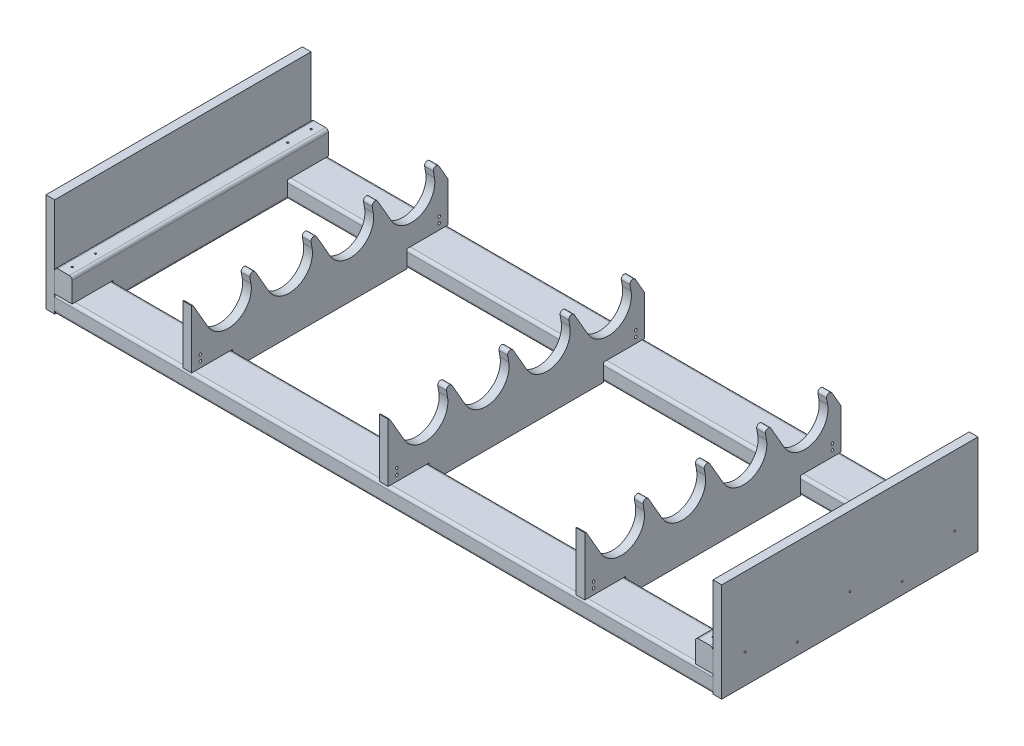
from build123d import *

# Parameters (mm, degrees)
SKETCH1_W                           = 1435.1
SKETCH1_H                           = 88.9
BOSS_EXTRUDE1_DEPTH                 = 38.1
BOSS_EXTRUDE1_2_DEPTH               = 38.1
FILLET2_R                           = 6.35
FILLET3_R                           = 6.35
BOSS_EXTRUDE4_DEPTH                 = 38.1
FILLET4_R                           = 6.35
TAP_DRILL_FOR_10_24_TAP1_AT_2_COUNT = 2
TAP_DRILL_FOR_10_24_TAP1_AT_2_PITCH = 50.8
TAP_DRILL_FOR_10_24_TAP1_AT_3_COUNT = 2
TAP_DRILL_FOR_10_24_TAP1_AT_3_PITCH = 469.9
TAP_DRILL_FOR_10_24_TAP1_AT_4_COUNT = 2
TAP_DRILL_FOR_10_24_TAP1_AT_4_PITCH = 520.7
TAP_DRILL_FOR_10_24_TAP1_AT_5_COUNT = 2
TAP_DRILL_FOR_10_24_TAP1_AT_5_PITCH = 1490.884801049
TAP_DRILL_FOR_10_24_TAP1_AT_6_COUNT = 2
TAP_DRILL_FOR_10_24_TAP1_AT_6_PITCH = 1473.911466134
TAP_DRILL_FOR_10_24_TAP1_AT_7_COUNT = 2
TAP_DRILL_FOR_10_24_TAP1_AT_7_PITCH = 1397.923331231
TAP_DRILL_FOR_10_24_TAP1_AT_8_COUNT = 2
TAP_DRILL_FOR_10_24_TAP1_AT_8_PITCH = 1397
SKETCH2_W                           = 558.8
SKETCH2_H                           = 215.9
BOSS_EXTRUDE2_DEPTH                 = 19.05
TAP_DRILL_FOR_10_24_TAP2_AT_2_COUNT = 2
TAP_DRILL_FOR_10_24_TAP2_AT_2_PITCH = 120.482778852
TAP_DRILL_FOR_10_24_TAP2_AT_3_COUNT = 2
TAP_DRILL_FOR_10_24_TAP2_AT_3_PITCH = 228.6
TAP_DRILL_FOR_10_24_TAP2_AT_4_COUNT = 2
TAP_DRILL_FOR_10_24_TAP2_AT_4_PITCH = 345.010173763
TAP_DRILL_FOR_10_24_TAP2_AT_5_COUNT = 2
TAP_DRILL_FOR_10_24_TAP2_AT_5_PITCH = 457.2
TAP_DRILL_FOR_10_24_TAP3_AT_2_COUNT = 2
TAP_DRILL_FOR_10_24_TAP3_AT_2_PITCH = 120.482778852
TAP_DRILL_FOR_10_24_TAP3_AT_3_COUNT = 2
TAP_DRILL_FOR_10_24_TAP3_AT_3_PITCH = 228.6
TAP_DRILL_FOR_10_24_TAP3_AT_4_COUNT = 2
TAP_DRILL_FOR_10_24_TAP3_AT_4_PITCH = 345.010173763
TAP_DRILL_FOR_10_24_TAP3_AT_5_COUNT = 2
TAP_DRILL_FOR_10_24_TAP3_AT_5_PITCH = 457.2
BOSS_EXTRUDE3_DEPTH                 = 19.05
CUT_EXTRUDE1_DEPTH                  = 19.05
FILLET1_R                           = 6.35
SKETCH14_W                          = 2.8067
SKETCH14_H                          = 19.051
F_10_CLEARANCE_HOLE1_AT_2_COUNT     = 2
F_10_CLEARANCE_HOLE1_AT_2_PITCH     = 12.7
F_10_CLEARANCE_HOLE1_AT_3_COUNT     = 2
F_10_CLEARANCE_HOLE1_AT_3_PITCH     = 520.7
F_10_CLEARANCE_HOLE1_AT_4_COUNT     = 2
F_10_CLEARANCE_HOLE1_AT_4_PITCH     = 520.854855022


with BuildPart() as part:
    # Sketch1 → Boss-Extrude1 (new body)
    with BuildSketch(Plane(origin=(0, 0, 0), x_dir=(1, 0, 0), z_dir=(0, 1, 0))):
        with Locations((0, 234.95)):
            Rectangle(SKETCH1_W, SKETCH1_H)
    extrude(amount=BOSS_EXTRUDE1_DEPTH)

    # Fillet3
    fillet3_edges = [part.edges().sort_by_distance(p)[0] for p in [
        (0, 38.1, -279.4),
        (0, 0, -279.4),
        (0, 0, -190.5),
        (0, 38.1, -190.5),
    ]]
    fillet(fillet3_edges, radius=FILLET3_R)


with BuildPart() as body_2:
    # Sketch1 → Boss-Extrude1 2 (new body)
    with BuildSketch(Plane(origin=(0, 0, 0), x_dir=(1, 0, 0), z_dir=(0, 1, 0))):
        with Locations((0, -234.95)):
            Rectangle(SKETCH1_W, SKETCH1_H)
    extrude(amount=BOSS_EXTRUDE1_2_DEPTH)

    # Fillet2
    fillet2_edges = [body_2.edges().sort_by_distance(p)[0] for p in [
        (0, 0, 190.5),
        (0, 0, 279.4),
        (0, 38.1, 190.5),
        (0, 38.1, 279.4),
    ]]
    fillet(fillet2_edges, radius=FILLET2_R)


with BuildPart() as body_3:
    # Sketch5 → Boss-Extrude4 (new body)
    with BuildSketch(Plane(origin=(717.55, 0, 0), x_dir=(0, 0, -1), z_dir=(1, 0, 0))):
        Polygon((-279.4, 88.9), (279.4, 88.9), (279.4, 38.1), (190.5, 38.1), (190.5, 0), (-190.5, 0), (-190.5, 38.1), (-279.4, 38.1), align=None)
    extrude(amount=-BOSS_EXTRUDE4_DEPTH)

    # Fillet4
    fillet4_edges = [body_3.edges().sort_by_distance(p)[0] for p in [
        (717.55, 0, 0),
        (679.45, 0, 0),
        (679.45, 88.9, 0),
        (717.55, 88.9, 0),
    ]]
    fillet(fillet4_edges, radius=FILLET4_R)


with BuildPart() as body_4:
    # Mirror6: mirrored copy
    add(body_3.part.mirror(Plane(origin=(0, 0, 0), x_dir=(0, 0, 1), z_dir=(1, 0, 0))))


with BuildPart() as tap_drill_for_10_24_tap1_tool:
    # Sketch8 → Tap Drill for #10-24 Tap1 (revolve)
    with BuildSketch(Plane(origin=(698.5, 88.9, 260.35), x_dir=(0, 0, 1), z_dir=(1, 0, 0))):
        Polygon((0, 0), (0, 77.340824014), (1.89865, 76.2), (1.89865, 0), align=None)
    tap_drill_for_10_24_tap1 = revolve(axis=Axis((698.5, 95.25, 260.35), (0, -1, 0)))


with BuildPart() as body_2_1:
    add(body_2.part)

    # Tap Drill for #10-24 Tap1: cut by tap_drill_for_10_24_tap1_tool
    add(tap_drill_for_10_24_tap1_tool.part, mode=Mode.SUBTRACT)


with BuildPart() as body_3_1:
    add(body_3.part)

    # Tap Drill for #10-24 Tap1: cut by tap_drill_for_10_24_tap1_tool
    add(tap_drill_for_10_24_tap1_tool.part, mode=Mode.SUBTRACT)


with BuildPart() as tap_drill_for_10_24_tap1_at_2_tool:
    # Tap Drill for #10-24 Tap1 at 2: Tap Drill for #10-24 Tap1 ×2
    with Locations(*[(0, 0, -i * TAP_DRILL_FOR_10_24_TAP1_AT_2_PITCH) for i in range(1, TAP_DRILL_FOR_10_24_TAP1_AT_2_COUNT)]):
        add(tap_drill_for_10_24_tap1)


with BuildPart() as body_2_2:
    add(body_2_1.part)

    # Tap Drill for #10-24 Tap1 at 2: cut by tap_drill_for_10_24_tap1_at_2_tool
    add(tap_drill_for_10_24_tap1_at_2_tool.part, mode=Mode.SUBTRACT)


with BuildPart() as body_3_2:
    add(body_3_1.part)

    # Tap Drill for #10-24 Tap1 at 2: cut by tap_drill_for_10_24_tap1_at_2_tool
    add(tap_drill_for_10_24_tap1_at_2_tool.part, mode=Mode.SUBTRACT)


with BuildPart() as tap_drill_for_10_24_tap1_at_3_tool:
    # Tap Drill for #10-24 Tap1 at 3: Tap Drill for #10-24 Tap1 ×2
    with Locations(*[(0, 0, -i * TAP_DRILL_FOR_10_24_TAP1_AT_3_PITCH) for i in range(1, TAP_DRILL_FOR_10_24_TAP1_AT_3_COUNT)]):
        add(tap_drill_for_10_24_tap1)


with BuildPart() as part_1:
    add(part.part)

    # Tap Drill for #10-24 Tap1 at 3: cut by tap_drill_for_10_24_tap1_at_3_tool
    add(tap_drill_for_10_24_tap1_at_3_tool.part, mode=Mode.SUBTRACT)


with BuildPart() as body_3_3:
    add(body_3_2.part)

    # Tap Drill for #10-24 Tap1 at 3: cut by tap_drill_for_10_24_tap1_at_3_tool
    add(tap_drill_for_10_24_tap1_at_3_tool.part, mode=Mode.SUBTRACT)


with BuildPart() as tap_drill_for_10_24_tap1_at_4_tool:
    # Tap Drill for #10-24 Tap1 at 4: Tap Drill for #10-24 Tap1 ×2
    with Locations(*[(0, 0, -i * TAP_DRILL_FOR_10_24_TAP1_AT_4_PITCH) for i in range(1, TAP_DRILL_FOR_10_24_TAP1_AT_4_COUNT)]):
        add(tap_drill_for_10_24_tap1)


with BuildPart() as part_2:
    add(part_1.part)

    # Tap Drill for #10-24 Tap1 at 4: cut by tap_drill_for_10_24_tap1_at_4_tool
    add(tap_drill_for_10_24_tap1_at_4_tool.part, mode=Mode.SUBTRACT)


with BuildPart() as body_3_4:
    add(body_3_3.part)

    # Tap Drill for #10-24 Tap1 at 4: cut by tap_drill_for_10_24_tap1_at_4_tool
    add(tap_drill_for_10_24_tap1_at_4_tool.part, mode=Mode.SUBTRACT)


with BuildPart() as tap_drill_for_10_24_tap1_at_5_tool:
    # Tap Drill for #10-24 Tap1 at 5: Tap Drill for #10-24 Tap1 ×2
    with Locations(*[Vector(-0.9370274611537509, 0, -0.34925569006639823) * (i * TAP_DRILL_FOR_10_24_TAP1_AT_5_PITCH) for i in range(1, TAP_DRILL_FOR_10_24_TAP1_AT_5_COUNT)]):
        add(tap_drill_for_10_24_tap1)


with BuildPart() as part_3:
    add(part_2.part)

    # Tap Drill for #10-24 Tap1 at 5: cut by tap_drill_for_10_24_tap1_at_5_tool
    add(tap_drill_for_10_24_tap1_at_5_tool.part, mode=Mode.SUBTRACT)


with BuildPart() as body_4_1:
    add(body_4.part)

    # Tap Drill for #10-24 Tap1 at 5: cut by tap_drill_for_10_24_tap1_at_5_tool
    add(tap_drill_for_10_24_tap1_at_5_tool.part, mode=Mode.SUBTRACT)


with BuildPart() as tap_drill_for_10_24_tap1_at_6_tool:
    # Tap Drill for #10-24 Tap1 at 6: Tap Drill for #10-24 Tap1 ×2
    with Locations(*[Vector(-0.9478181234756763, 0, -0.31881155062363686) * (i * TAP_DRILL_FOR_10_24_TAP1_AT_6_PITCH) for i in range(1, TAP_DRILL_FOR_10_24_TAP1_AT_6_COUNT)]):
        add(tap_drill_for_10_24_tap1)


with BuildPart() as part_4:
    add(part_3.part)

    # Tap Drill for #10-24 Tap1 at 6: cut by tap_drill_for_10_24_tap1_at_6_tool
    add(tap_drill_for_10_24_tap1_at_6_tool.part, mode=Mode.SUBTRACT)


with BuildPart() as body_4_2:
    add(body_4_1.part)

    # Tap Drill for #10-24 Tap1 at 6: cut by tap_drill_for_10_24_tap1_at_6_tool
    add(tap_drill_for_10_24_tap1_at_6_tool.part, mode=Mode.SUBTRACT)


with BuildPart() as tap_drill_for_10_24_tap1_at_7_tool:
    # Tap Drill for #10-24 Tap1 at 7: Tap Drill for #10-24 Tap1 ×2
    with Locations(*[Vector(-0.9993394979464322, 0, -0.03633961810714282) * (i * TAP_DRILL_FOR_10_24_TAP1_AT_7_PITCH) for i in range(1, TAP_DRILL_FOR_10_24_TAP1_AT_7_COUNT)]):
        add(tap_drill_for_10_24_tap1)


with BuildPart() as body_2_3:
    add(body_2_2.part)

    # Tap Drill for #10-24 Tap1 at 7: cut by tap_drill_for_10_24_tap1_at_7_tool
    add(tap_drill_for_10_24_tap1_at_7_tool.part, mode=Mode.SUBTRACT)


with BuildPart() as body_4_3:
    add(body_4_2.part)

    # Tap Drill for #10-24 Tap1 at 7: cut by tap_drill_for_10_24_tap1_at_7_tool
    add(tap_drill_for_10_24_tap1_at_7_tool.part, mode=Mode.SUBTRACT)


with BuildPart() as tap_drill_for_10_24_tap1_at_8_tool:
    # Tap Drill for #10-24 Tap1 at 8: Tap Drill for #10-24 Tap1 ×2
    with Locations(*[(-i * TAP_DRILL_FOR_10_24_TAP1_AT_8_PITCH, 0, 0) for i in range(1, TAP_DRILL_FOR_10_24_TAP1_AT_8_COUNT)]):
        add(tap_drill_for_10_24_tap1)


with BuildPart() as body_2_4:
    add(body_2_3.part)

    # Tap Drill for #10-24 Tap1 at 8: cut by tap_drill_for_10_24_tap1_at_8_tool
    add(tap_drill_for_10_24_tap1_at_8_tool.part, mode=Mode.SUBTRACT)


with BuildPart() as body_4_4:
    add(body_4_3.part)

    # Tap Drill for #10-24 Tap1 at 8: cut by tap_drill_for_10_24_tap1_at_8_tool
    add(tap_drill_for_10_24_tap1_at_8_tool.part, mode=Mode.SUBTRACT)


with BuildPart() as body_5:
    # Sketch2 → Boss-Extrude2 (new body)
    with BuildSketch(Plane(origin=(717.55, 0, 0), x_dir=(0, 0, -1), z_dir=(1, 0, 0))):
        with Locations((0, 107.95)):
            Rectangle(SKETCH2_W, SKETCH2_H)
    extrude(amount=BOSS_EXTRUDE2_DEPTH)


with BuildPart() as body_6:
    # Mirror2: mirrored copy
    add(body_5.part.mirror(Plane(origin=(0, 0, 0), x_dir=(0, 0, 1), z_dir=(1, 0, 0))))


with BuildPart() as tap_drill_for_10_24_tap2_tool:
    # Sketch10 → Tap Drill for #10-24 Tap2 (revolve)
    with BuildSketch(Plane(origin=(736.6, 63.5, 228.6), x_dir=(0, 0, -1), z_dir=(0, 1, 0))):
        Polygon((0, 0), (0, 39.240824014), (1.89865, 38.1), (1.89865, 0), align=None)
    tap_drill_for_10_24_tap2 = revolve(axis=Axis((742.95, 63.5, 228.6), (-1, 0, 0)))


with BuildPart() as body_3_5:
    add(body_3_4.part)

    # Tap Drill for #10-24 Tap2: cut by tap_drill_for_10_24_tap2_tool
    add(tap_drill_for_10_24_tap2_tool.part, mode=Mode.SUBTRACT)


with BuildPart() as body_5_1:
    add(body_5.part)

    # Tap Drill for #10-24 Tap2: cut by tap_drill_for_10_24_tap2_tool
    add(tap_drill_for_10_24_tap2_tool.part, mode=Mode.SUBTRACT)


with BuildPart() as tap_drill_for_10_24_tap2_at_2_tool:
    # Tap Drill for #10-24 Tap2 at 2: Tap Drill for #10-24 Tap2 ×2
    with Locations(*[Vector(-2.358985217731327e-15, -0.31622776601683794, -0.9486832980505139) * (i * TAP_DRILL_FOR_10_24_TAP2_AT_2_PITCH) for i in range(1, TAP_DRILL_FOR_10_24_TAP2_AT_2_COUNT)]):
        add(tap_drill_for_10_24_tap2)


with BuildPart() as body_3_6:
    add(body_3_5.part)

    # Tap Drill for #10-24 Tap2 at 2: cut by tap_drill_for_10_24_tap2_at_2_tool
    add(tap_drill_for_10_24_tap2_at_2_tool.part, mode=Mode.SUBTRACT)


with BuildPart() as body_5_2:
    add(body_5_1.part)

    # Tap Drill for #10-24 Tap2 at 2: cut by tap_drill_for_10_24_tap2_at_2_tool
    add(tap_drill_for_10_24_tap2_at_2_tool.part, mode=Mode.SUBTRACT)


with BuildPart() as tap_drill_for_10_24_tap2_at_3_tool:
    # Tap Drill for #10-24 Tap2 at 3: Tap Drill for #10-24 Tap2 ×2
    with Locations(*[(0, 0, -i * TAP_DRILL_FOR_10_24_TAP2_AT_3_PITCH) for i in range(1, TAP_DRILL_FOR_10_24_TAP2_AT_3_COUNT)]):
        add(tap_drill_for_10_24_tap2)


with BuildPart() as body_3_7:
    add(body_3_6.part)

    # Tap Drill for #10-24 Tap2 at 3: cut by tap_drill_for_10_24_tap2_at_3_tool
    add(tap_drill_for_10_24_tap2_at_3_tool.part, mode=Mode.SUBTRACT)


with BuildPart() as body_5_3:
    add(body_5_2.part)

    # Tap Drill for #10-24 Tap2 at 3: cut by tap_drill_for_10_24_tap2_at_3_tool
    add(tap_drill_for_10_24_tap2_at_3_tool.part, mode=Mode.SUBTRACT)


with BuildPart() as tap_drill_for_10_24_tap2_at_4_tool:
    # Tap Drill for #10-24 Tap2 at 4: Tap Drill for #10-24 Tap2 ×2
    with Locations(*[Vector(-2.47138011500423e-15, -0.11043152607484656, -0.9938837346736189) * (i * TAP_DRILL_FOR_10_24_TAP2_AT_4_PITCH) for i in range(1, TAP_DRILL_FOR_10_24_TAP2_AT_4_COUNT)]):
        add(tap_drill_for_10_24_tap2)


with BuildPart() as body_3_8:
    add(body_3_7.part)

    # Tap Drill for #10-24 Tap2 at 4: cut by tap_drill_for_10_24_tap2_at_4_tool
    add(tap_drill_for_10_24_tap2_at_4_tool.part, mode=Mode.SUBTRACT)


with BuildPart() as body_5_4:
    add(body_5_3.part)

    # Tap Drill for #10-24 Tap2 at 4: cut by tap_drill_for_10_24_tap2_at_4_tool
    add(tap_drill_for_10_24_tap2_at_4_tool.part, mode=Mode.SUBTRACT)


with BuildPart() as tap_drill_for_10_24_tap2_at_5_tool:
    # Tap Drill for #10-24 Tap2 at 5: Tap Drill for #10-24 Tap2 ×2
    with Locations(*[(0, 0, -i * TAP_DRILL_FOR_10_24_TAP2_AT_5_PITCH) for i in range(1, TAP_DRILL_FOR_10_24_TAP2_AT_5_COUNT)]):
        add(tap_drill_for_10_24_tap2)


with BuildPart() as body_3_9:
    add(body_3_8.part)

    # Tap Drill for #10-24 Tap2 at 5: cut by tap_drill_for_10_24_tap2_at_5_tool
    add(tap_drill_for_10_24_tap2_at_5_tool.part, mode=Mode.SUBTRACT)


with BuildPart() as body_5_5:
    add(body_5_4.part)

    # Tap Drill for #10-24 Tap2 at 5: cut by tap_drill_for_10_24_tap2_at_5_tool
    add(tap_drill_for_10_24_tap2_at_5_tool.part, mode=Mode.SUBTRACT)


with BuildPart() as tap_drill_for_10_24_tap3_tool:
    # Sketch12 → Tap Drill for #10-24 Tap3 (revolve)
    with BuildSketch(Plane(origin=(-736.6, 63.5, -228.6), x_dir=(0, 0, 1), z_dir=(0, 1, 0))):
        Polygon((0, 0), (0, 39.240824014), (1.89865, 38.1), (1.89865, 0), align=None)
    tap_drill_for_10_24_tap3 = revolve(axis=Axis((-742.95, 63.5, -228.6), (1, 0, 0)))


with BuildPart() as body_4_5:
    add(body_4_4.part)

    # Tap Drill for #10-24 Tap3: cut by tap_drill_for_10_24_tap3_tool
    add(tap_drill_for_10_24_tap3_tool.part, mode=Mode.SUBTRACT)


with BuildPart() as body_6_1:
    add(body_6.part)

    # Tap Drill for #10-24 Tap3: cut by tap_drill_for_10_24_tap3_tool
    add(tap_drill_for_10_24_tap3_tool.part, mode=Mode.SUBTRACT)


with BuildPart() as tap_drill_for_10_24_tap3_at_2_tool:
    # Tap Drill for #10-24 Tap3 at 2: Tap Drill for #10-24 Tap3 ×2
    with Locations(*[Vector(-2.3589852177313265e-15, -0.31622776601683794, 0.9486832980505139) * (i * TAP_DRILL_FOR_10_24_TAP3_AT_2_PITCH) for i in range(1, TAP_DRILL_FOR_10_24_TAP3_AT_2_COUNT)]):
        add(tap_drill_for_10_24_tap3)


with BuildPart() as body_4_6:
    add(body_4_5.part)

    # Tap Drill for #10-24 Tap3 at 2: cut by tap_drill_for_10_24_tap3_at_2_tool
    add(tap_drill_for_10_24_tap3_at_2_tool.part, mode=Mode.SUBTRACT)


with BuildPart() as body_6_2:
    add(body_6_1.part)

    # Tap Drill for #10-24 Tap3 at 2: cut by tap_drill_for_10_24_tap3_at_2_tool
    add(tap_drill_for_10_24_tap3_at_2_tool.part, mode=Mode.SUBTRACT)


with BuildPart() as tap_drill_for_10_24_tap3_at_3_tool:
    # Tap Drill for #10-24 Tap3 at 3: Tap Drill for #10-24 Tap3 ×2
    with Locations(*[(0, 0, i * TAP_DRILL_FOR_10_24_TAP3_AT_3_PITCH) for i in range(1, TAP_DRILL_FOR_10_24_TAP3_AT_3_COUNT)]):
        add(tap_drill_for_10_24_tap3)


with BuildPart() as body_4_7:
    add(body_4_6.part)

    # Tap Drill for #10-24 Tap3 at 3: cut by tap_drill_for_10_24_tap3_at_3_tool
    add(tap_drill_for_10_24_tap3_at_3_tool.part, mode=Mode.SUBTRACT)


with BuildPart() as body_6_3:
    add(body_6_2.part)

    # Tap Drill for #10-24 Tap3 at 3: cut by tap_drill_for_10_24_tap3_at_3_tool
    add(tap_drill_for_10_24_tap3_at_3_tool.part, mode=Mode.SUBTRACT)


with BuildPart() as tap_drill_for_10_24_tap3_at_4_tool:
    # Tap Drill for #10-24 Tap3 at 4: Tap Drill for #10-24 Tap3 ×2
    with Locations(*[Vector(-2.4713801150042298e-15, -0.11043152607484655, 0.9938837346736189) * (i * TAP_DRILL_FOR_10_24_TAP3_AT_4_PITCH) for i in range(1, TAP_DRILL_FOR_10_24_TAP3_AT_4_COUNT)]):
        add(tap_drill_for_10_24_tap3)


with BuildPart() as body_4_8:
    add(body_4_7.part)

    # Tap Drill for #10-24 Tap3 at 4: cut by tap_drill_for_10_24_tap3_at_4_tool
    add(tap_drill_for_10_24_tap3_at_4_tool.part, mode=Mode.SUBTRACT)


with BuildPart() as body_6_4:
    add(body_6_3.part)

    # Tap Drill for #10-24 Tap3 at 4: cut by tap_drill_for_10_24_tap3_at_4_tool
    add(tap_drill_for_10_24_tap3_at_4_tool.part, mode=Mode.SUBTRACT)


with BuildPart() as tap_drill_for_10_24_tap3_at_5_tool:
    # Tap Drill for #10-24 Tap3 at 5: Tap Drill for #10-24 Tap3 ×2
    with Locations(*[(0, 0, i * TAP_DRILL_FOR_10_24_TAP3_AT_5_PITCH) for i in range(1, TAP_DRILL_FOR_10_24_TAP3_AT_5_COUNT)]):
        add(tap_drill_for_10_24_tap3)


with BuildPart() as body_4_9:
    add(body_4_8.part)

    # Tap Drill for #10-24 Tap3 at 5: cut by tap_drill_for_10_24_tap3_at_5_tool
    add(tap_drill_for_10_24_tap3_at_5_tool.part, mode=Mode.SUBTRACT)


with BuildPart() as body_6_5:
    add(body_6_4.part)

    # Tap Drill for #10-24 Tap3 at 5: cut by tap_drill_for_10_24_tap3_at_5_tool
    add(tap_drill_for_10_24_tap3_at_5_tool.part, mode=Mode.SUBTRACT)


with BuildPart() as body_7:
    # Sketch4 → Boss-Extrude3 (new body)
    with BuildSketch(Plane.ZY.offset(-438.15)):
        with BuildLine():
            Line((110.669090512, 107.95), (158.601543276, 190.971443518))
            Line((158.601543276, 190.971443518), (149.996766147, 142.171327425))
            ThreePointArc((149.996766147, 142.171327425), (182.650376719, 85.613614864), (244.019090512, 107.95))
            Line((244.019090512, 107.95), (275.821987595, 163.034233575))
            ThreePointArc((275.821987595, 163.034233575), (277.334233575, 164.546479555), (279.4, 165.1))
            Line((279.4, 165.1), (279.4, 38.1))
            Line((279.4, 38.1), (190.5, 38.1))
            Line((190.5, 38.1), (190.5, 0))
            Line((190.5, 0), (-190.5, 0))
            Line((-190.5, 0), (-190.5, 38.1))
            Line((-190.5, 38.1), (-279.4, 38.1))
            Line((-279.4, 38.1), (-279.4, 190.971443518))
            Line((-279.4, 190.971443518), (-241.448456724, 190.971443518))
            Line((-241.448456724, 190.971443518), (-250.053233853, 142.171327425))
            ThreePointArc((-250.053233853, 142.171327425), (-217.399623281, 85.613614864), (-156.030909488, 107.95))
            Line((-156.030909488, 107.95), (-108.098456724, 190.971443518))
            Line((-108.098456724, 190.971443518), (-116.703233853, 142.171327425))
            ThreePointArc((-116.703233853, 142.171327425), (-84.049623281, 85.613614864), (-22.680909488, 107.95))
            Line((-22.680909488, 107.95), (25.251543276, 190.971443518))
            Line((25.251543276, 190.971443518), (16.646766147, 142.171327425))
            ThreePointArc((16.646766147, 142.171327425), (49.300376719, 85.613614864), (110.669090512, 107.95))
        make_face()
    extrude(amount=BOSS_EXTRUDE3_DEPTH)

    # Sketch15 → Cut-Extrude1 (cut)
    with BuildSketch(Plane.ZY.offset(-419.1)):
        with BuildLine():
            Line((-241.448456724, 190.971443518), (-384.175, 190.971443518))
            Line((-384.175, 190.971443518), (-384.175, 133.35))
            ThreePointArc((-384.175, 133.35), (-346.523007491, 84.280968025), (-289.380909488, 107.95))
            Line((-289.380909488, 107.95), (-241.448456724, 190.971443518))
        make_face()
    extrude(amount=-CUT_EXTRUDE1_DEPTH, mode=Mode.SUBTRACT)

    # Fillet1
    fillet1_edges = [body_7.edges().sort_by_distance(p)[0] for p in [
        (428.625, 190.971443518, 158.601543276),
        (428.625, 190.971443518, -241.448456724),
        (428.625, 190.971443518, -108.098456724),
        (428.625, 190.971443518, 25.251543276),
        (428.625, 125.237442339, -279.4),
    ]]
    fillet(fillet1_edges, radius=FILLET1_R)

    # Sketch14 → #10 Clearance Hole1 (revolve, cut)
    with BuildSketch(Plane(origin=(438.15, 50.8, 260.35), x_dir=(0, 0, -1), z_dir=(0, 1, 0))):
        with Locations((1.40335, 9.5255)):
            Rectangle(SKETCH14_W, SKETCH14_H)
    f_10_clearance_hole1 = revolve(axis=Axis((444.5, 50.8, 260.35), (-1, 0, 0)), mode=Mode.SUBTRACT)

    # #10 Clearance Hole1 at 2: #10 Clearance Hole1 ×2
    with Locations(*[(0, i * F_10_CLEARANCE_HOLE1_AT_2_PITCH, 0) for i in range(1, F_10_CLEARANCE_HOLE1_AT_2_COUNT)]):
        add(f_10_clearance_hole1, mode=Mode.SUBTRACT)

    # #10 Clearance Hole1 at 3: #10 Clearance Hole1 ×2
    with Locations(*[(0, 0, -i * F_10_CLEARANCE_HOLE1_AT_3_PITCH) for i in range(1, F_10_CLEARANCE_HOLE1_AT_3_COUNT)]):
        add(f_10_clearance_hole1, mode=Mode.SUBTRACT)

    # #10 Clearance Hole1 at 4: #10 Clearance Hole1 ×2
    with Locations(*[Vector(-2.4862284059309747e-15, 0.024382992454708548, -0.99970269064305) * (i * F_10_CLEARANCE_HOLE1_AT_4_PITCH) for i in range(1, F_10_CLEARANCE_HOLE1_AT_4_COUNT)]):
        add(f_10_clearance_hole1, mode=Mode.SUBTRACT)


with BuildPart() as body_8:
    # Mirror4: mirrored copy
    add(body_7.part.mirror(Plane(origin=(0, 0, 0), x_dir=(0, 0, 1), z_dir=(1, 0, 0))))


with BuildPart() as body_9:
    # Body-Move/Copy1: copy of body 7
    add(body_7.part.moved(Location((-428.625, 0, 0))))


solid = Compound([part_4.part, body_2_4.part, body_3_9.part, body_5_5.part, body_4_9.part, body_6_5.part, body_7.part, body_8.part, body_9.part])
